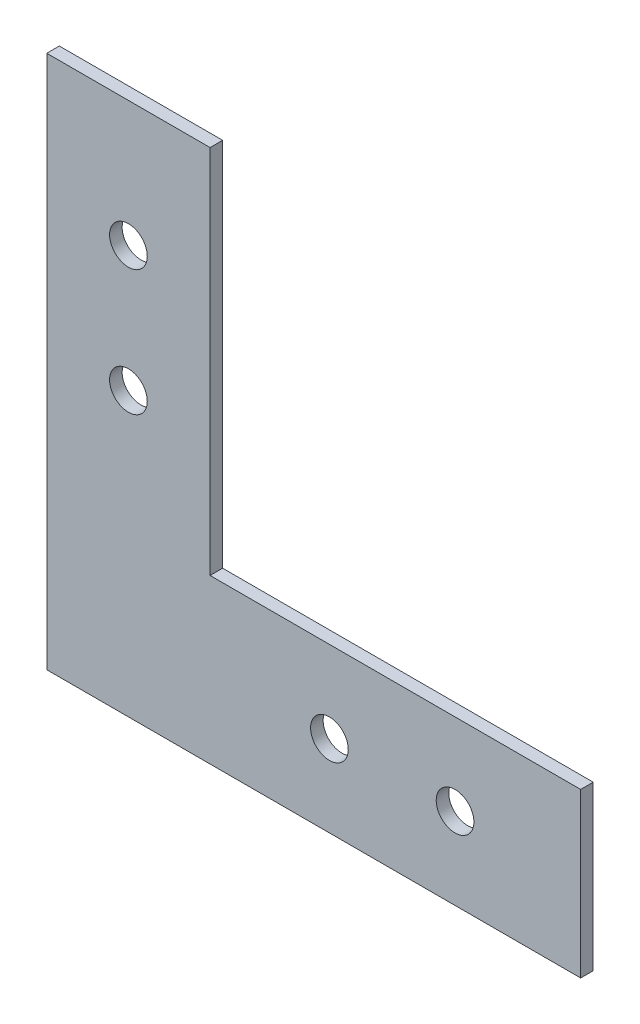
from build123d import *

# Parameters (mm, degrees)
SKETCH_1_W          = 26
SKETCH_1_H          = 85
EXTRUDE_1_DEPTH     = 2
SKETCH_2_R          = 3
CUT_EXTRUDE_1_DEPTH = 10


with BuildPart() as part:
    # 草图1 → 凸台-拉伸1 (new body)
    with BuildSketch(Plane.XY):
        Rectangle(SKETCH_1_W, SKETCH_1_H)
    extrude_1 = extrude(amount=EXTRUDE_1_DEPTH)

    # 镜向1: 凸台-拉伸1 across plane
    add(extrude_1.mirror(Plane(origin=(14.75, -14.75, 0), x_dir=(0, 0, 1), z_dir=(0.7071067811865488, -0.7071067811865464, 0))))

    # 草图2 → 切除-拉伸1 (cut)
    with BuildSketch(Plane.XY.offset(2)):
        with Locations((0, 22.5)):
            Circle(SKETCH_2_R)
        with Locations((0, 2.5)):
            Circle(SKETCH_2_R)
    cut_extrude_1 = extrude(amount=-CUT_EXTRUDE_1_DEPTH, mode=Mode.SUBTRACT)

    # 镜向2: 切除-拉伸1 across plane
    add(cut_extrude_1.mirror(Plane(origin=(14.75, -14.75, 0), x_dir=(0, 0, 1), z_dir=(0.7071067811865479, -0.7071067811865471, 0))), mode=Mode.SUBTRACT)


solid = part.part
